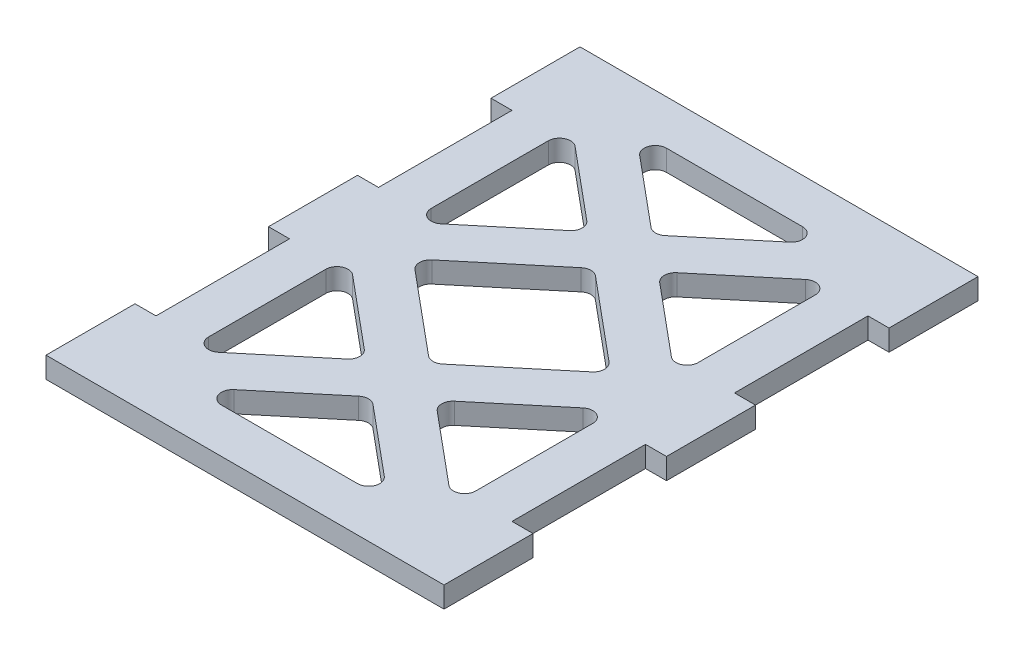
from build123d import *

# Parameters (mm, degrees)
SKETCH1_W           = 50.8
SKETCH1_H           = 76.2
BOSS_EXTRUDE1_DEPTH = 2.9972
SKETCH2_W           = 2.9972
SKETCH2_H           = 12.7
BOSS_EXTRUDE2_DEPTH = 2.9972
SKETCH3_W           = 38.1
SKETCH3_H           = 63.5
CUT_EXTRUDE1_DEPTH  = 48.612962265
EXTRUDE_THIN1_DEPTH = 2.9972
FILLET1_R           = 1.5875


with BuildPart() as part:
    # Sketch1 → Boss-Extrude1 (new body)
    with BuildSketch(Plane(origin=(0, 0, 0), x_dir=(1, 0, 0), z_dir=(0, 1, 0))):
        Rectangle(SKETCH1_W, SKETCH1_H)
    extrude(amount=BOSS_EXTRUDE1_DEPTH)

    # Sketch2 → Boss-Extrude2 (add)
    with BuildSketch(Plane(origin=(0, 2.9972, 0), x_dir=(1, 0, 0), z_dir=(0, 1, 0))):
        with Locations((26.8986, 0)):
            Rectangle(SKETCH2_W, SKETCH2_H)
        with Locations((26.8986, 31.75)):
            Rectangle(SKETCH2_W, SKETCH2_H)
        with Locations((26.8986, -31.75)):
            Rectangle(SKETCH2_W, SKETCH2_H)
        with Locations((-26.8986, 0)):
            Rectangle(SKETCH2_W, SKETCH2_H)
        with Locations((-26.8986, -31.75)):
            Rectangle(SKETCH2_W, SKETCH2_H)
        with Locations((-26.8986, 31.75)):
            Rectangle(SKETCH2_W, SKETCH2_H)
    extrude(amount=-BOSS_EXTRUDE2_DEPTH)

    # Sketch3 → Cut-Extrude1 (cut, through all)
    with BuildSketch(Plane(origin=(0, 2.9972, 0), x_dir=(1, 0, 0), z_dir=(0, 1, 0))):
        Rectangle(SKETCH3_W, SKETCH3_H)
    extrude(amount=-CUT_EXTRUDE1_DEPTH, mode=Mode.SUBTRACT)

    # Sketch4 → Extrude-Thin1 (add)
    with BuildSketch(Plane(origin=(0, 2.9972, 0), x_dir=(1, 0, 0), z_dir=(0, 1, 0))):
        Polygon((-21.082585469, 29.310897437), (14.090491456, 0), (-21.082585469, -29.310897437), (-17.017414531, -34.189102563), (24.009508544, 0), (-17.017414531, 34.189102563), align=None)
        Polygon((21.082585469, -29.310897437), (-14.090491456, 0), (21.082585469, 29.310897437), (17.017414531, 34.189102563), (-24.009508544, 0), (17.017414531, -34.189102563), align=None)
    extrude(amount=-EXTRUDE_THIN1_DEPTH)

    # Fillet1
    fillet1_edges = [part.edges().sort_by_distance(p)[0] for p in [
        (14.090491456, 1.4986, 31.75),
        (-14.090491456, 1.4986, 31.75),
        (19.05, 1.4986, -27.617076213),
        (19.05, 1.4986, 27.617076213),
        (19.05, 1.4986, 4.132923787),
        (19.05, 1.4986, -4.132923787),
        (14.090491456, 1.4986, -31.75),
        (-14.090491456, 1.4986, -31.75),
        (-19.05, 1.4986, -4.132923787),
        (-19.05, 1.4986, 4.132923787),
        (-19.05, 1.4986, -27.617076213),
        (-19.05, 1.4986, 27.617076213),
        (-4.959508544, 1.4986, 15.875),
        (-4.959508544, 1.4986, -15.875),
        (0, 1.4986, -20.007923787),
        (4.959508544, 1.4986, -15.875),
        (4.959508544, 1.4986, 15.875),
        (0, 1.4986, 20.007923787),
        (14.090491456, 1.4986, 0),
        (0, 1.4986, -11.742076213),
        (0, 1.4986, 11.742076213),
        (-14.090491456, 1.4986, 0),
    ]]
    fillet(fillet1_edges, radius=FILLET1_R)


solid = part.part
